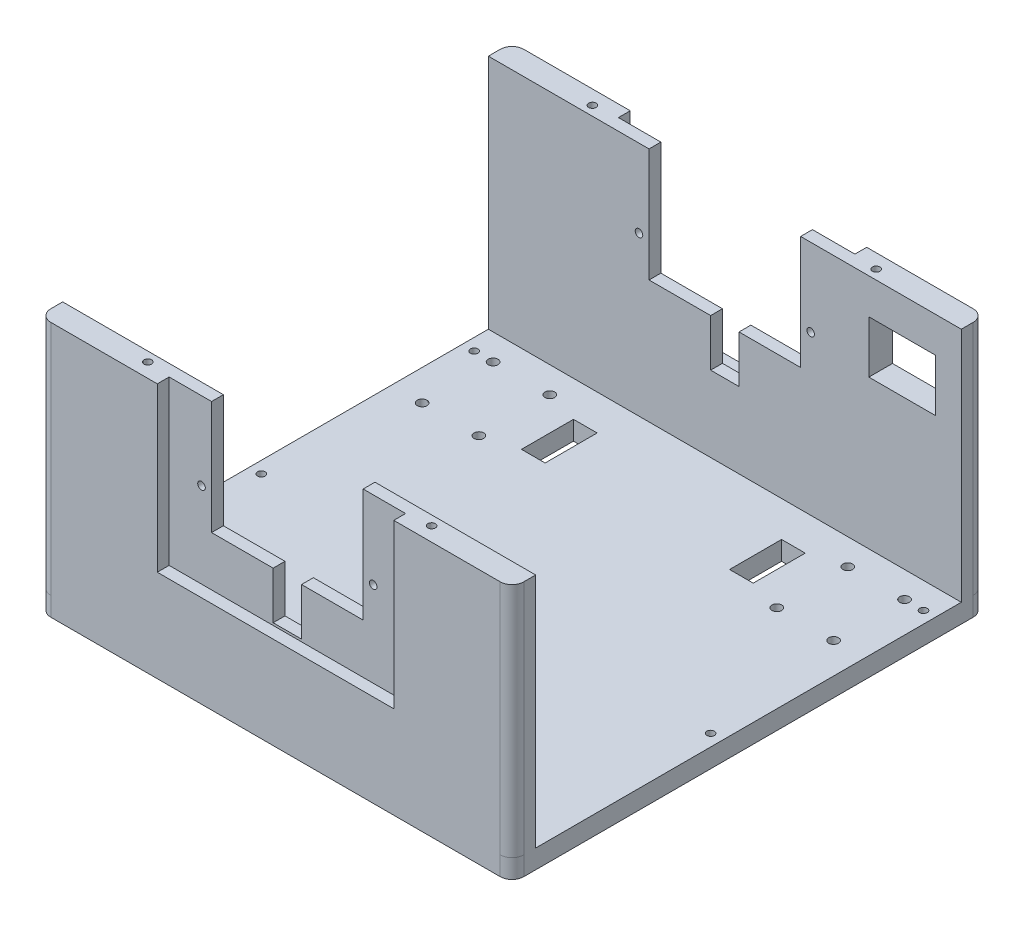
from build123d import *

# Parameters (mm, degrees)
SKETCH_1_W          = 200
SKETCH_1_H          = 200
SKETCH_1_R          = 2.05
SKETCH_1_R_2        = 1.6
SKETCH_1_R_3        = 2.1
SKETCH_1_W_2        = 10
SKETCH_1_H_2        = 22
EXTRUDE_1_DEPTH     = 8
FILLET_1_R          = 5
FILLET_2_R          = 5
FILLET_3_R          = 5
FILLET_4_R          = 5
SKETCH_2_W          = 200
SKETCH_2_H          = 10
EXTRUDE_2_DEPTH     = 100
FILLET_5_R          = 5
FILLET_6_R          = 5
FILLET_7_R          = 5
FILLET_8_R          = 5
SKETCH_3_R          = 1.6
CUT_EXTRUDE_1_DEPTH = 1000
SKETCH_4_W          = 100
SKETCH_4_H          = 69
CUT_EXTRUDE_2_DEPTH = 5
SKETCH_6_R          = 1.6
CUT_EXTRUDE_3_DEPTH = 6
SKETCH_7_W          = 28.1
SKETCH_7_H          = 22.1
CUT_EXTRUDE_4_DEPTH = 100


with BuildPart() as part:
    # 草图1 → 凸台-拉伸1 (new body)
    with BuildSketch(Plane(origin=(0, 0, 0), x_dir=(1, 0, 0), z_dir=(0, 1, 0))):
        Rectangle(SKETCH_1_W, SKETCH_1_H)
        with Locations(Location((-87, 49, 0), (0, 0, 270))):
            Circle(SKETCH_1_R, mode=Mode.SUBTRACT)
        with Locations(Location((-63, 49, 0), (0, 0, 270))):
            Circle(SKETCH_1_R, mode=Mode.SUBTRACT)
        with Locations(Location((-63, 79, 0), (0, 0, 270))):
            Circle(SKETCH_1_R, mode=Mode.SUBTRACT)
        with Locations(Location((-87, 79, 0), (0, 0, 270))):
            Circle(SKETCH_1_R, mode=Mode.SUBTRACT)
        with Locations(Location((87, 49, 0), (0, 0, 90))):
            Circle(SKETCH_1_R, mode=Mode.SUBTRACT)
        with Locations(Location((63, 49, 0), (0, 0, 90))):
            Circle(SKETCH_1_R, mode=Mode.SUBTRACT)
        with Locations(Location((63, 79, 0), (0, 0, 90))):
            Circle(SKETCH_1_R, mode=Mode.SUBTRACT)
        with Locations(Location((87, 79, 0), (0, 0, 90))):
            Circle(SKETCH_1_R, mode=Mode.SUBTRACT)
        with Locations(Location((-95, 79, 0), (0, 0, 270))):
            Circle(SKETCH_1_R_2, mode=Mode.SUBTRACT)
        with Locations(Location((95, 79, 0), (0, 0, 270))):
            Circle(SKETCH_1_R_2, mode=Mode.SUBTRACT)
        with Locations(Location((95, -11, 0), (0, 0, 270))):
            Circle(SKETCH_1_R_2, mode=Mode.SUBTRACT)
        with Locations(Location((-95, -11, 0), (0, 0, 270))):
            Circle(SKETCH_1_R_2, mode=Mode.SUBTRACT)
        with Locations(Location((0, -22, 0), (0, 0, 270))):
            Circle(SKETCH_1_R_3, mode=Mode.SUBTRACT)
        with Locations(Location((0, -84, 0), (0, 0, 270))):
            Circle(SKETCH_1_R_3, mode=Mode.SUBTRACT)
        with Locations(Location((-22.5, -80, 0), (0, 0, 270))):
            Circle(SKETCH_1_R_3, mode=Mode.SUBTRACT)
        with Locations(Location((22.5, -80, 0), (0, 0, 90))):
            Circle(SKETCH_1_R_3, mode=Mode.SUBTRACT)
        with Locations((44, 64)):
            Rectangle(SKETCH_1_W_2, SKETCH_1_H_2, mode=Mode.SUBTRACT)
        with Locations((-44, 64)):
            Rectangle(SKETCH_1_W_2, SKETCH_1_H_2, mode=Mode.SUBTRACT)
    extrude(amount=EXTRUDE_1_DEPTH)

    # 圆角1
    fillet_1_edges = [part.edges().sort_by_distance(p)[0] for p in [
        (-100, 4, 100),
    ]]
    fillet(fillet_1_edges, radius=FILLET_1_R)

    # 圆角2
    fillet_2_edges = [part.edges().sort_by_distance(p)[0] for p in [
        (100, 4, 100),
    ]]
    fillet(fillet_2_edges, radius=FILLET_2_R)

    # 圆角3
    fillet_3_edges = [part.edges().sort_by_distance(p)[0] for p in [
        (100, 4, -100),
    ]]
    fillet(fillet_3_edges, radius=FILLET_3_R)

    # 圆角4
    fillet_4_edges = [part.edges().sort_by_distance(p)[0] for p in [
        (-100, 4, -100),
    ]]
    fillet(fillet_4_edges, radius=FILLET_4_R)

    # 草图2 → 凸台-拉伸2 (add)
    with BuildSketch(Plane(origin=(0, 8, 0), x_dir=(1, 0, 0), z_dir=(0, 1, 0))):
        with Locations((0, -95)):
            Rectangle(SKETCH_2_W, SKETCH_2_H)
        with Locations((0, 95)):
            Rectangle(SKETCH_2_W, SKETCH_2_H)
    extrude(amount=EXTRUDE_2_DEPTH)

    # 圆角5
    fillet_5_edges = [part.edges().sort_by_distance(p)[0] for p in [
        (100, 58, -100),
    ]]
    fillet(fillet_5_edges, radius=FILLET_5_R)

    # 圆角6
    fillet_6_edges = [part.edges().sort_by_distance(p)[0] for p in [
        (-100, 58, -100),
    ]]
    fillet(fillet_6_edges, radius=FILLET_6_R)

    # 圆角7
    fillet_7_edges = [part.edges().sort_by_distance(p)[0] for p in [
        (-100, 58, 100),
    ]]
    fillet(fillet_7_edges, radius=FILLET_7_R)

    # 圆角8
    fillet_8_edges = [part.edges().sort_by_distance(p)[0] for p in [
        (100, 58, 100),
    ]]
    fillet(fillet_8_edges, radius=FILLET_8_R)

    # 草图3 → 切除-拉伸1 (cut)
    with BuildSketch(Plane(origin=(0, 0, -100), x_dir=(-1, 0, 0), z_dir=(0, 0, -1))):
        with Locations((-36.3, 75.05)):
            Circle(SKETCH_3_R)
        with Locations((36.3, 75.05)):
            Circle(SKETCH_3_R)
        Polygon((-32.05, 108), (32.05, 108), (32.05, 60), (6, 60), (6, 40), (-6, 40), (-6, 60), (-32.05, 60), align=None)
    extrude(amount=-CUT_EXTRUDE_1_DEPTH, mode=Mode.SUBTRACT)

    # 草图4 → 切除-拉伸2 (cut)
    with BuildSketch(Plane(origin=(0, 0, -100), x_dir=(-1, 0, 0), z_dir=(0, 0, -1))):
        with Locations((0, 73.5)):
            Rectangle(SKETCH_4_W, SKETCH_4_H)
    cut_extrude_2 = extrude(amount=-CUT_EXTRUDE_2_DEPTH, mode=Mode.SUBTRACT)

    # 镜向1: 切除-拉伸2 across plane
    add(cut_extrude_2.mirror(Plane.XY), mode=Mode.SUBTRACT)

    # 草图6 → 切除-拉伸3 (cut)
    with BuildSketch(Plane(origin=(0, 108, 0), x_dir=(1, 0, 0), z_dir=(0, 1, 0))):
        with Locations(Location((-60, 94, 0), (0, 0, 270))):
            Circle(SKETCH_6_R)
        with Locations(Location((60, 94, 0), (0, 0, 90))):
            Circle(SKETCH_6_R)
    cut_extrude_3 = extrude(amount=-CUT_EXTRUDE_3_DEPTH, mode=Mode.SUBTRACT)

    # 镜向2: 切除-拉伸3 across plane
    add(cut_extrude_3.mirror(Plane.XY), mode=Mode.SUBTRACT)

    # 草图7 → 切除-拉伸4 (cut)
    with BuildSketch(Plane(origin=(0, 0, -100), x_dir=(-1, 0, 0), z_dir=(0, 0, -1))):
        with Locations((-74.95, 81.95)):
            Rectangle(SKETCH_7_W, SKETCH_7_H)
    extrude(amount=-CUT_EXTRUDE_4_DEPTH, mode=Mode.SUBTRACT)


solid = part.part
